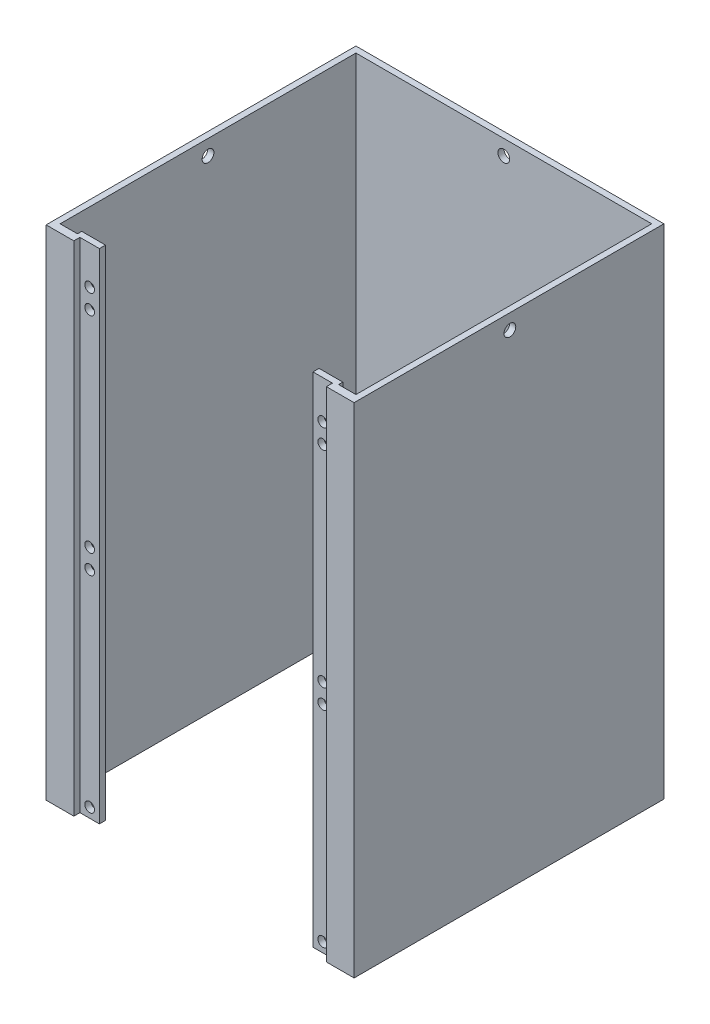
from build123d import *

# Parameters (mm, degrees)
BOSS_EXTRUDE1_DEPTH = 327.5
SKETCH7_W           = 83
SKETCH7_H           = 2
CUT_EXTRUDE7_DEPTH  = 203
SKETCH2_R           = 1.6
CUT_EXTRUDE2_DEPTH  = 10
SKETCH3_R           = 1.93
CUT_EXTRUDE3_DEPTH  = 102
SKETCH4_R           = 1.93
CUT_EXTRUDE4_DEPTH  = 10
SKETCH5_W           = 130.251709281
SKETCH5_H           = 163.75
CUT_EXTRUDE6_DEPTH  = 231


with BuildPart() as part:
    # Sketch1 → Boss-Extrude1 (new body)
    with BuildSketch(Plane(origin=(0, 0, 0), x_dir=(1, 0, 0), z_dir=(0, 1, 0))):
        Polygon((0, -0.603), (0, 101.206), (101.206, 101.206), (101.206, -0.6), (91.5, -0.6), (91.5, 1.4), (85.703, 1.4), (85.703, 3.4), (93.5, 3.4), (93.5, 2), (99.206, 2), (99.206, 99.206), (2, 99.206), (2, 2), (7.706, 2), (7.706, 3.397), (15.503, 3.397), (15.503, 1.397), (9.706, 1.397), (9.706, -0.603), align=None)
    extrude(amount=BOSS_EXTRUDE1_DEPTH)

    # Sketch7 → Cut-Extrude7 (cut)
    with BuildSketch(Plane(origin=(0, 327.5, 0), x_dir=(1, 0, 0), z_dir=(0, 1, 0))):
        with Locations((50.603, 0.397)):
            Rectangle(SKETCH7_W, SKETCH7_H)
    extrude(amount=-CUT_EXTRUDE7_DEPTH, mode=Mode.SUBTRACT)

    # Sketch2 → Cut-Extrude2 (cut)
    with BuildSketch(Plane.XY.offset(-1.397)):
        with Locations((12.303, 314.9)):
            Circle(SKETCH2_R)
        with Locations((12.303, 308.5)):
            Circle(SKETCH2_R)
        with Locations((88.903, 314.9)):
            Circle(SKETCH2_R)
        with Locations((88.903, 308.5)):
            Circle(SKETCH2_R)
        with Locations((12.303, 240.925)):
            Circle(SKETCH2_R)
        with Locations((12.303, 234.525)):
            Circle(SKETCH2_R)
        with Locations((88.903, 240.925)):
            Circle(SKETCH2_R)
        with Locations((88.903, 234.525)):
            Circle(SKETCH2_R)
        with Locations((12.303, 166.95)):
            Circle(SKETCH2_R)
        with Locations((12.303, 160.55)):
            Circle(SKETCH2_R)
        with Locations((88.903, 166.95)):
            Circle(SKETCH2_R)
        with Locations((88.903, 160.55)):
            Circle(SKETCH2_R)
        with Locations((12.303, 92.975)):
            Circle(SKETCH2_R)
        with Locations((12.303, 86.575)):
            Circle(SKETCH2_R)
        with Locations((88.903, 92.975)):
            Circle(SKETCH2_R)
        with Locations((88.903, 86.575)):
            Circle(SKETCH2_R)
        with Locations((12.303, 19)):
            Circle(SKETCH2_R)
        with Locations((12.303, 12.6)):
            Circle(SKETCH2_R)
        with Locations((88.903, 19)):
            Circle(SKETCH2_R)
        with Locations((88.903, 12.6)):
            Circle(SKETCH2_R)
    extrude(amount=-CUT_EXTRUDE2_DEPTH, mode=Mode.SUBTRACT)

    # Sketch3 → Cut-Extrude3 (cut)
    with BuildSketch(Plane(origin=(101.206, 0, 0), x_dir=(0, 0, -1), z_dir=(1, 0, 0))):
        with Locations((50.603, 322.524)):
            Circle(SKETCH3_R)
        with Locations((50.603, 4.976)):
            Circle(SKETCH3_R)
    extrude(amount=-CUT_EXTRUDE3_DEPTH, mode=Mode.SUBTRACT)

    # Sketch4 → Cut-Extrude4 (cut)
    with BuildSketch(Plane(origin=(0, 0, -101.206), x_dir=(-1, 0, 0), z_dir=(0, 0, -1))):
        with Locations((-50.603, 322.524)):
            Circle(SKETCH4_R)
        with Locations((-50.603, 4.976)):
            Circle(SKETCH4_R)
    extrude(amount=-CUT_EXTRUDE4_DEPTH, mode=Mode.SUBTRACT)

    # Sketch5 → Cut-Extrude6 (cut)
    with BuildSketch(Plane.ZY):
        with Locations((-36.08014536, 81.875)):
            Rectangle(SKETCH5_W, SKETCH5_H)
    extrude(amount=-CUT_EXTRUDE6_DEPTH, mode=Mode.SUBTRACT)


solid = part.part
